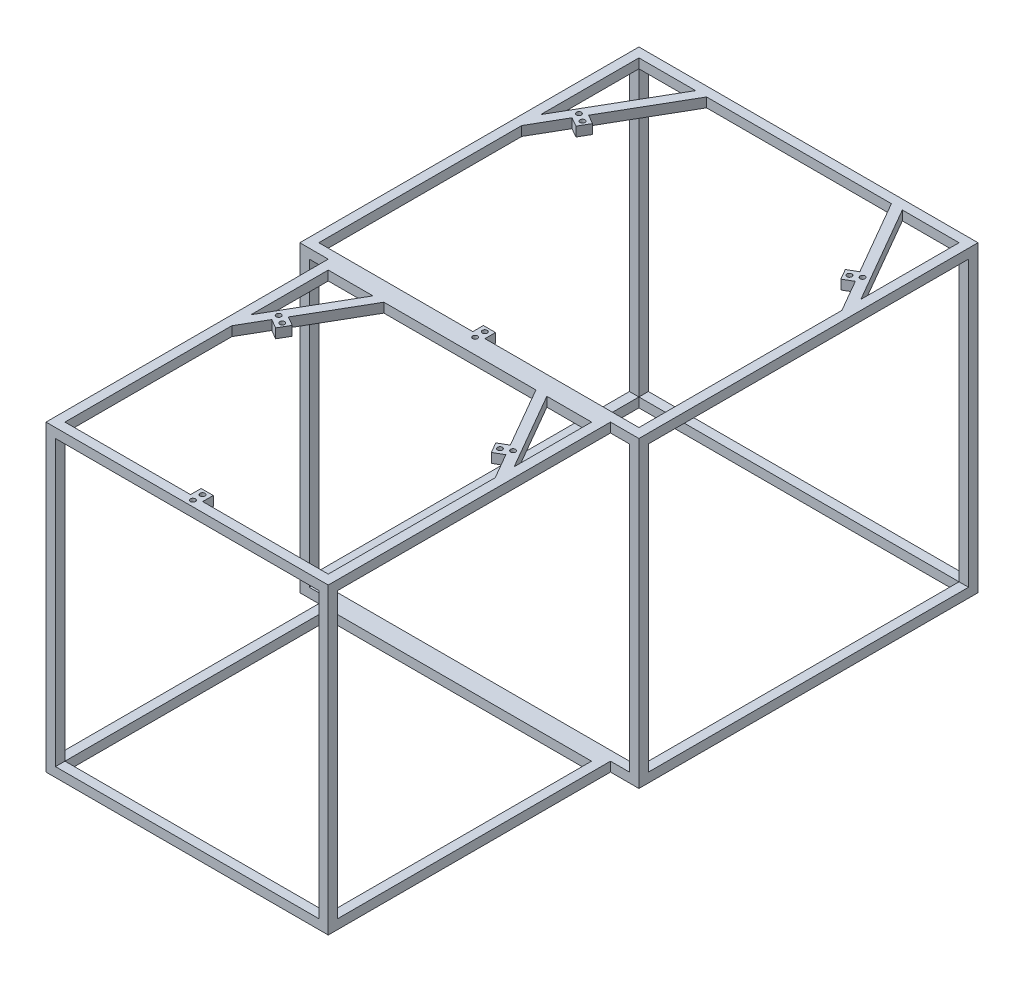
from build123d import *

# Parameters (mm, degrees)
BOSS_EXTRUDE1_DEPTH = 25
SKETCH2_R           = 6.5
CUT_EXTRUDE1_DEPTH  = 25
SKETCH3_W           = 25
SKETCH3_H           = 25
BOSS_EXTRUDE2_DEPTH = 750
SKETCH4_W           = 844.9
SKETCH4_H           = 844.9
SKETCH4_W_2         = 694.9
SKETCH4_H_2         = 694.9
BOSS_EXTRUDE3_DEPTH = 25


with BuildPart() as part:
    # Sketch1 → Boss-Extrude1 (new body)
    with BuildSketch(Plane(origin=(0, 0, 0), x_dir=(1, 0, 0), z_dir=(0, 1, 0))):
        Polygon((-447.45, -447.45), (-447.45, 447.45), (447.45, 447.45), (447.45, -447.45), (372.45, -447.45), (372.45, -1192.35), (-372.45, -1192.35), (-372.45, -447.45), align=None)
        Polygon((-422.45, 422.45), (-272.769134679, 422.45), (-422.45, 163.195136343), align=None, mode=Mode.SUBTRACT)
        Polygon((422.45, 113.195136343), (422.45, -422.45), (16, -422.45), (16, -394.45), (-16, -394.45), (-16, -422.45), (-422.45, -422.45), (-422.45, 113.195136343), (-373.852431829, 197.368593539), (-349.603720523, 183.368593539), (-333.603720523, 211.081406461), (-357.852431829, 225.081406461), (-243.901621219, 422.45), (243.901621219, 422.45), (357.852431829, 225.081406461), (333.603720523, 211.081406461), (349.603720523, 183.368593539), (373.852431829, 197.368593539), align=None, mode=Mode.SUBTRACT)
        Polygon((272.769134679, 422.45), (422.45, 163.195136343), (422.45, 422.45), align=None, mode=Mode.SUBTRACT)
        Polygon((-347.45, -472.45), (-229.467864489, -472.45), (-347.45, -676.80105309), align=None, mode=Mode.SUBTRACT)
        Polygon((229.467864489, -472.45), (347.45, -472.45), (347.45, -676.80105309), align=None, mode=Mode.SUBTRACT)
        Polygon((-200.60035103, -472.45), (200.60035103, -472.45), (292.900526545, -632.318593539), (268.651815239, -646.318593539), (284.651815239, -674.031406461), (308.900526545, -660.031406461), (347.45, -726.80105309), (347.45, -1167.35), (16, -1167.35), (16, -1139.35), (-16, -1139.35), (-16, -1167.35), (-347.45, -1167.35), (-347.45, -726.80105309), (-308.900526545, -660.031406461), (-284.651815239, -674.031406461), (-268.651815239, -646.318593539), (-292.900526545, -632.318593539), align=None, mode=Mode.SUBTRACT)
    extrude(amount=BOSS_EXTRUDE1_DEPTH)

    # Sketch2 → Cut-Extrude1 (cut)
    with BuildSketch(Plane(origin=(0, 25, 0), x_dir=(1, 0, 0), z_dir=(0, 1, 0))):
        with Locations(Location((0, -432.2, 0), (0, 0, 270))):
            Circle(SKETCH2_R)
        with Locations(Location((374.296179516, 216.1, 0), (0, 0, 270))):
            Circle(SKETCH2_R)
        with Locations(Location((352.212531719, 203.35, 0), (0, 0, 270))):
            Circle(SKETCH2_R)
        with Locations(Location((-374.296179516, 216.1, 0), (0, 0, 270))):
            Circle(SKETCH2_R)
        with Locations(Location((-352.212531719, 203.35, 0), (0, 0, 270))):
            Circle(SKETCH2_R)
        with Locations(Location((0, -1177.1, 0), (0, 0, 270))):
            Circle(SKETCH2_R)
        with Locations(Location((0, -1151.6, 0), (0, 0, 270))):
            Circle(SKETCH2_R)
        with Locations(Location((-309.344274232, -641.3, 0), (0, 0, 270))):
            Circle(SKETCH2_R)
        with Locations(Location((-287.260626435, -654.05, 0), (0, 0, 270))):
            Circle(SKETCH2_R)
        with Locations(Location((309.344274232, -641.3, 0), (0, 0, 270))):
            Circle(SKETCH2_R)
        with Locations(Location((287.260626435, -654.05, 0), (0, 0, 270))):
            Circle(SKETCH2_R)
        with Locations(Location((0, -406.7, 0), (0, 0, 270))):
            Circle(SKETCH2_R)
    extrude(amount=-CUT_EXTRUDE1_DEPTH, mode=Mode.SUBTRACT)

    # Sketch3 → Boss-Extrude2 (add)
    with BuildSketch(Plane.XZ):
        with Locations((-359.95, 1179.85)):
            Rectangle(SKETCH3_W, SKETCH3_H)
        with Locations((359.95, 1179.85)):
            Rectangle(SKETCH3_W, SKETCH3_H)
        with Locations((434.95, 434.95)):
            Rectangle(SKETCH3_W, SKETCH3_H)
        with Locations((-434.95, 434.95)):
            Rectangle(SKETCH3_W, SKETCH3_H)
        with Locations((434.95, -434.95)):
            Rectangle(SKETCH3_W, SKETCH3_H)
        with Locations((-434.95, -434.95)):
            Rectangle(SKETCH3_W, SKETCH3_H)
    extrude(amount=BOSS_EXTRUDE2_DEPTH)

    # Sketch4 → Boss-Extrude3 (add)
    with BuildSketch(Plane.XZ.offset(750)):
        Polygon((-372.45, 447.45), (-372.45, 1192.35), (372.45, 1192.35), (372.45, 447.45), (447.45, 447.45), (447.45, -447.45), (-447.45, -447.45), (-447.45, 447.45), align=None)
        Rectangle(SKETCH4_W, SKETCH4_H, mode=Mode.SUBTRACT)
        with Locations((0, 819.9)):
            Rectangle(SKETCH4_W_2, SKETCH4_H_2, mode=Mode.SUBTRACT)
    extrude(amount=BOSS_EXTRUDE3_DEPTH)


solid = part.part
